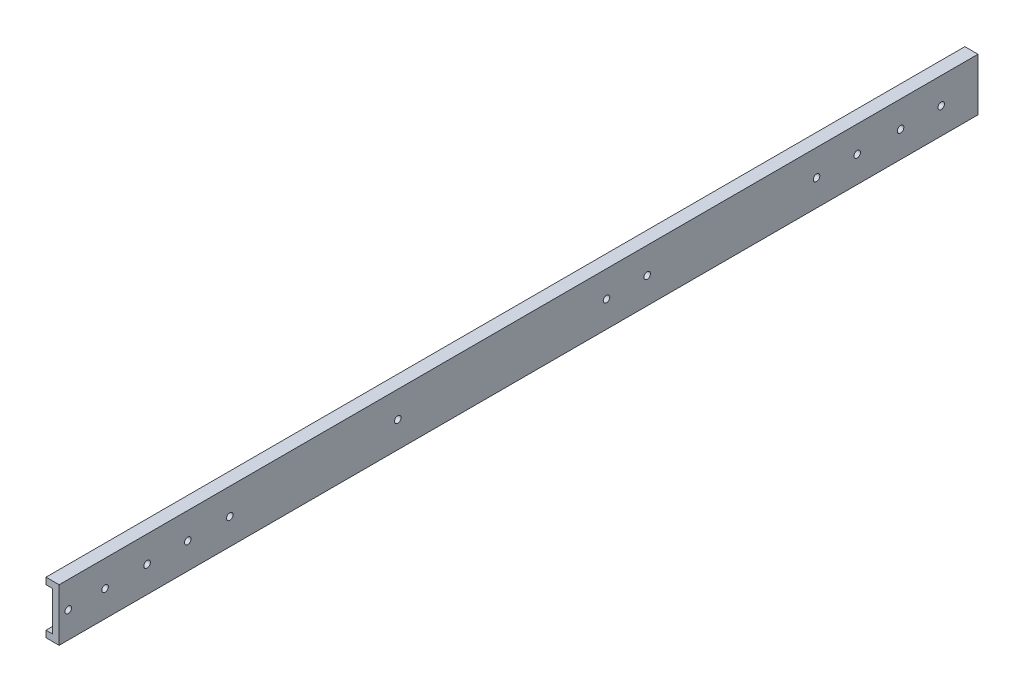
from build123d import *

# Parameters (mm, degrees)
SKETCH1_W               = 10
SKETCH1_H               = 40
BOSS_EXTRUDE1_DEPTH     = 700
CUT_EXTRUDE1_DEPTH      = 702.21323433
CUT_EXTRUDE1_DEPTH_BACK = 702.21323433
SKETCH2_W               = 5
SKETCH2_H               = 30
SKETCH3_R               = 2.5
CUT_EXTRUDE2_DEPTH      = 702.21323433


with BuildPart() as part:
    # Sketch1 → Boss-Extrude1 (new body)
    with BuildSketch(Plane.XY):
        with Locations((5, 20)):
            Rectangle(SKETCH1_W, SKETCH1_H)
    extrude(amount=BOSS_EXTRUDE1_DEPTH)

    # Sketch2 → Cut-Extrude1 (cut, two sides: drawn at the far end of the back side and taken through both)
    with BuildSketch(Plane.XY.offset(700).offset(-CUT_EXTRUDE1_DEPTH_BACK)):
        with Locations((2.5, 20)):
            Rectangle(SKETCH2_W, SKETCH2_H)
    extrude(amount=CUT_EXTRUDE1_DEPTH + CUT_EXTRUDE1_DEPTH_BACK, mode=Mode.SUBTRACT)

    # Sketch3 → Cut-Extrude2 (cut, through all)
    with BuildSketch(Plane(origin=(10, 0, 0), x_dir=(0, 0, -1), z_dir=(1, 0, 0))):
        with Locations((-693, 20)):
            Circle(SKETCH3_R)
        with Locations((-665, 20)):
            Circle(SKETCH3_R)
        with Locations((-633, 20)):
            Circle(SKETCH3_R)
        with Locations((-602, 20)):
            Circle(SKETCH3_R)
        with Locations((-570, 20)):
            Circle(SKETCH3_R)
        with Locations((-442, 20)):
            Circle(SKETCH3_R)
        with Locations((-283, 20)):
            Circle(SKETCH3_R)
        with Locations((-252, 20)):
            Circle(SKETCH3_R)
        with Locations((-123, 20)):
            Circle(SKETCH3_R)
        with Locations((-92, 20)):
            Circle(SKETCH3_R)
        with Locations((-59, 20)):
            Circle(SKETCH3_R)
        with Locations((-28, 20)):
            Circle(SKETCH3_R)
    extrude(amount=-CUT_EXTRUDE2_DEPTH, mode=Mode.SUBTRACT)


solid = part.part
